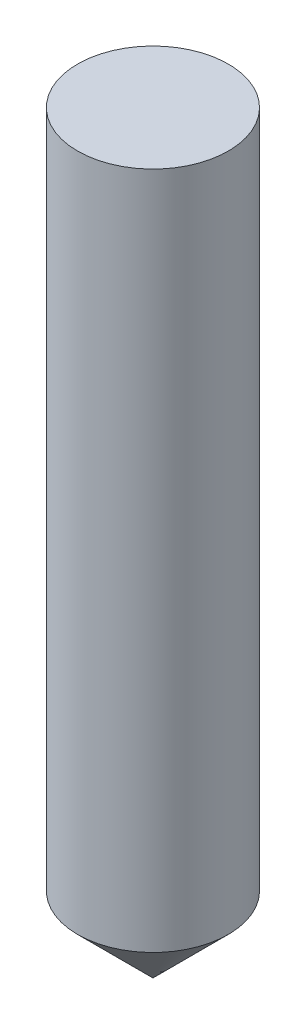
from build123d import *

# Parameters (mm, degrees)
SKETCH1_R           = 5
BOSS_EXTRUDE1_DEPTH = 50
CHAMFER1_SIZE       = 5


with BuildPart() as part:
    # Sketch1 → Boss-Extrude1 (new body)
    with BuildSketch(Plane(origin=(0, 0, 0), x_dir=(1, 0, 0), z_dir=(0, 1, 0))):
        Circle(SKETCH1_R)
    extrude(amount=BOSS_EXTRUDE1_DEPTH)

    # Chamfer1
    chamfer1_edges = [part.edges().sort_by_distance(p)[0] for p in [
        (-5, 0, 0),
    ]]
    chamfer(chamfer1_edges, length=CHAMFER1_SIZE)


solid = part.part
